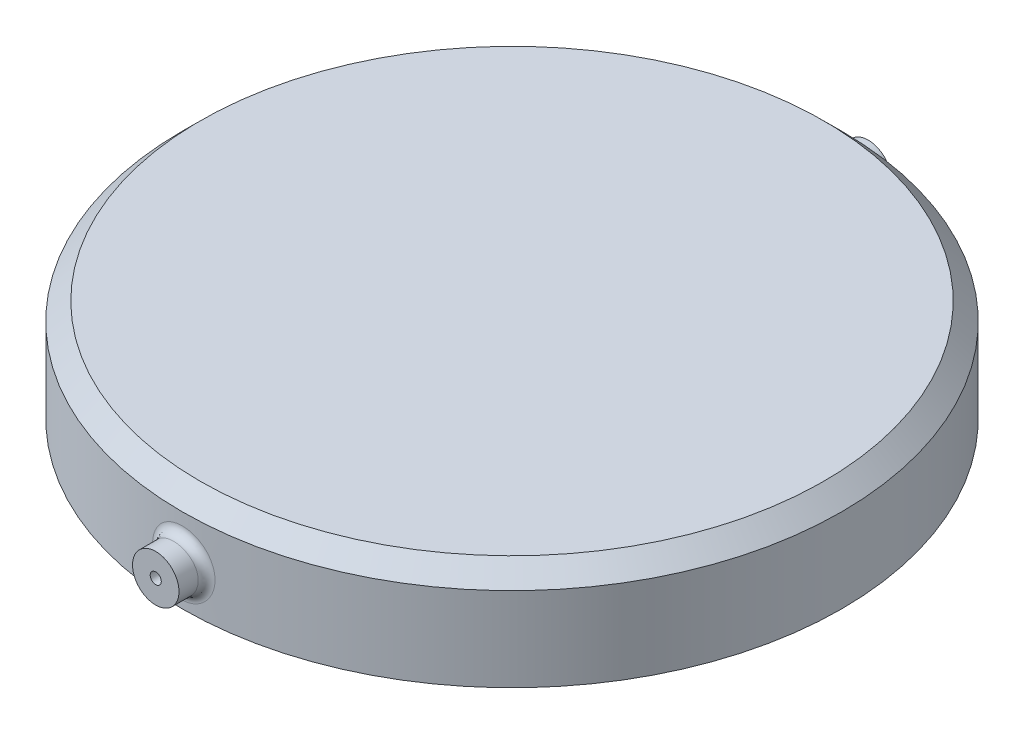
from build123d import *

# Parameters (mm, degrees)
SKETCH1_R           = 37.25
SKETCH1_R_2         = 35.5
BOSS_EXTRUDE1_DEPTH = 10
BOSS_EXTRUDE2_START = 1.5
SKETCH1_2_R         = 37.25
BOSS_EXTRUDE2_DEPTH = 1.5
CHAMFER1_SIZE       = 1.5
CHAMFER2_SIZE       = 2
SKETCH2_R           = 0.625
CUT_EXTRUDE1_DEPTH  = 10
BOSS_EXTRUDE4_START = 3
SKETCH2_3_R         = 2.625
SKETCH2_3_R_2       = 0.625
BOSS_EXTRUDE4_DEPTH = 4
BOSS_EXTRUDE6_START = -1
BOSS_EXTRUDE6_DEPTH = 5
FILLET1_R           = 1


with BuildPart() as part:
    # Sketch1 → Boss-Extrude1 (new body)
    with BuildSketch(Plane(origin=(0, 0, 0), x_dir=(1, 0, 0), z_dir=(0, 1, 0))):
        Circle(SKETCH1_R)
        Circle(SKETCH1_R_2, mode=Mode.SUBTRACT)
    extrude(amount=-BOSS_EXTRUDE1_DEPTH)

    # Sketch1<2> → Boss-Extrude2 (add)
    with BuildSketch(Plane(origin=(0, 0, 0), x_dir=(1, 0, 0), z_dir=(0, 1, 0)).offset(BOSS_EXTRUDE2_START)):
        Circle(SKETCH1_2_R)
    extrude(amount=-BOSS_EXTRUDE2_DEPTH)

    # Chamfer1
    chamfer1_edges = [part.edges().sort_by_distance(p)[0] for p in [
        (-35.5, 0, 0),
    ]]
    chamfer(chamfer1_edges, length=CHAMFER1_SIZE)

    # Chamfer2
    chamfer2_edges = [part.edges().sort_by_distance(p)[0] for p in [
        (-37.25, 1.5, 0),
    ]]
    chamfer(chamfer2_edges, length=CHAMFER2_SIZE)

    # Sketch2 → Cut-Extrude1 (cut)
    with BuildSketch(Plane.XY.offset(37.25)):
        with Locations((0, -5.5)):
            Circle(SKETCH2_R)
    cut_extrude1 = extrude(amount=-CUT_EXTRUDE1_DEPTH, mode=Mode.SUBTRACT)

    # Sketch2<3> → Boss-Extrude4 (add)
    with BuildSketch(Plane.XY.offset(37.25).offset(BOSS_EXTRUDE4_START)):
        with Locations((0, -5.5)):
            Circle(SKETCH2_3_R)
        with Locations((0, -5.5)):
            Circle(SKETCH2_3_R_2, mode=Mode.SUBTRACT)
    boss_extrude4 = extrude(amount=-BOSS_EXTRUDE4_DEPTH)

    # Mirror1: Cut-Extrude1, Boss-Extrude4 across plane
    add(cut_extrude1.mirror(Plane.XY), mode=Mode.SUBTRACT)
    add(boss_extrude4.mirror(Plane.XY))

    # tirangle → Boss-Extrude6 (add)
    with BuildSketch(Plane(origin=(37.25, 0, 0), x_dir=(0, 0, -1), z_dir=(1, 0, 0)).offset(BOSS_EXTRUDE6_START)):
        Polygon((2.5, -0.5), (-2.5, -0.5), (0, -3), align=None)
    boss_extrude6 = extrude(amount=-BOSS_EXTRUDE6_DEPTH)

    # Mirror2: Boss-Extrude6 across plane
    add(boss_extrude6.mirror(Plane(origin=(0, 0, 0), x_dir=(0, 0, 1), z_dir=(1, 0, 0))))

    # Fillet1
    fillet1_edges = [part.edges().sort_by_distance(p)[0] for p in [
        (-2.625, -5.5, -37.157393275),
        (-2.624999999, -5.5, 37.157393276),
    ]]
    fillet(fillet1_edges, radius=FILLET1_R)


solid = part.part
